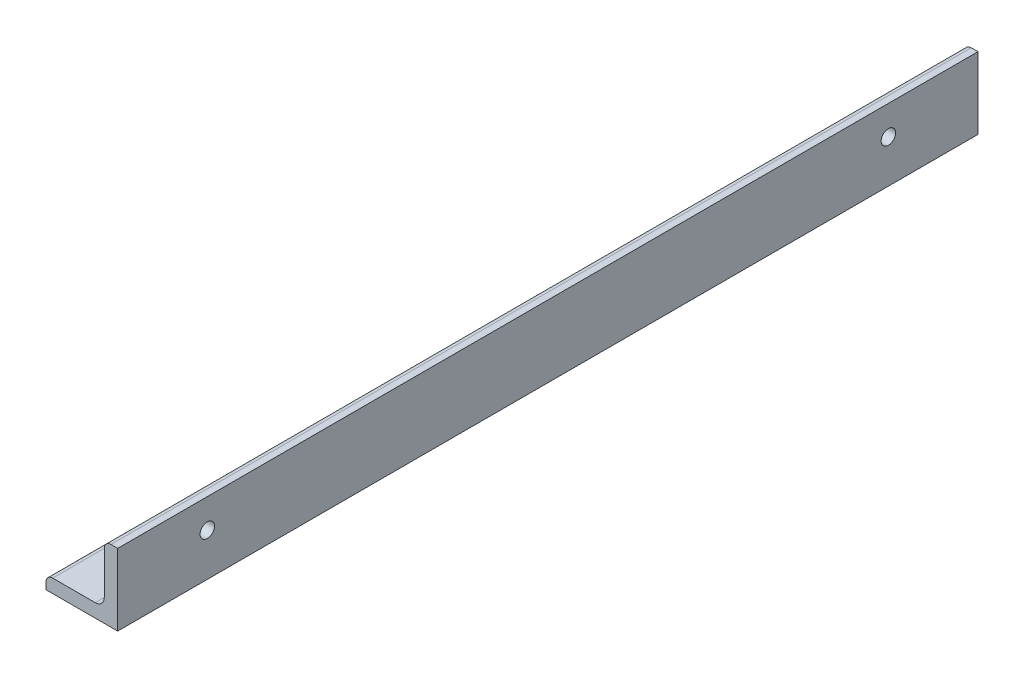
from build123d import *

# Parameters (mm, degrees)
BOSS_EXTRUDE1_DEPTH    = 152.4
F_10_CLEARANCE_HOLE2_D = 5.1054
F_10_CLEARANCE_HOLE3_D = 5.1054


with BuildPart() as part:
    # Sketch2 → Boss-Extrude1 (new, symmetric)
    with BuildSketch(Plane.XY):
        with BuildLine():
            Line((-12.7, 0), (12.7, 0))
            Line((12.7, 0), (12.7, 25.4))
            Line((12.7, 25.4), (10.31875, 25.4))
            ThreePointArc((10.31875, 25.4), (8.634951977, 24.702548023), (7.9375, 23.01875))
            Line((7.9375, 23.01875), (7.9375, 7.9375))
            ThreePointArc((7.9375, 7.9375), (7.00756403, 5.69243597), (4.7625, 4.7625))
            Line((4.7625, 4.7625), (-10.31875, 4.7625))
            ThreePointArc((-10.31875, 4.7625), (-12.002548023, 4.065048023), (-12.7, 2.38125))
            Line((-12.7, 2.38125), (-12.7, 0))
        make_face()
    extrude(amount=BOSS_EXTRUDE1_DEPTH, both=True)

    # #10 Clearance Hole2 (through all)
    with Locations(Plane(origin=(12.7, 0, 0), x_dir=(0, 0, -1), z_dir=(1, 0, 0))):
        with Locations((-120.65, 15.113), (120.65, 15.113)):
            Hole(F_10_CLEARANCE_HOLE2_D / 2)

    # #10 Clearance Hole3 (through all)
    with Locations(Plane(origin=(0, 0, 0), x_dir=(-1, 0, 0), z_dir=(0, -1, 0))):
        with Locations((2.413, -120.65), (2.413, 120.65)):
            Hole(F_10_CLEARANCE_HOLE3_D / 2)


solid = part.part
